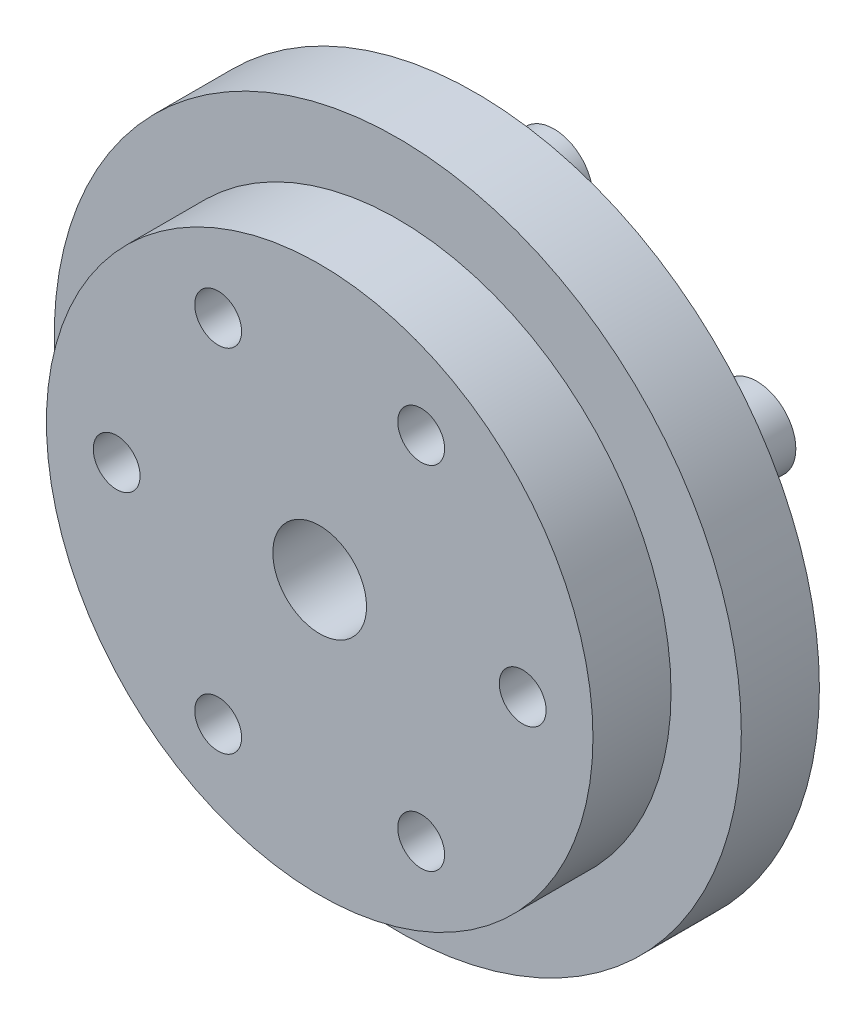
from build123d import *

# Parameters (mm, degrees)
SKETCH1_R           = 22
BOSS_EXTRUDE1_DEPTH = 5
SKETCH2_R           = 17.5
BOSS_EXTRUDE2_DEPTH = 5
SKETCH4_R           = 8
CUT_EXTRUDE2_DEPTH  = 10
SKETCH5_R           = 1.5
CUT_EXTRUDE3_DEPTH  = 3
SKETCH7_R           = 2.5
BOSS_EXTRUDE4_DEPTH = 5
SKETCH8_R           = 8
SKETCH8_R_2         = 3
BOSS_EXTRUDE5_DEPTH = 5


with BuildPart() as part:
    # Sketch1 → Boss-Extrude1 (new body)
    with BuildSketch(Plane.XY):
        Circle(SKETCH1_R)
    extrude(amount=BOSS_EXTRUDE1_DEPTH)

    # Sketch2 → Boss-Extrude2 (add)
    with BuildSketch(Plane.XY.offset(5)):
        Circle(SKETCH2_R)
    extrude(amount=BOSS_EXTRUDE2_DEPTH)

    # Sketch4 → Cut-Extrude2 (cut)
    with BuildSketch(Plane.XY.offset(10)):
        Circle(SKETCH4_R)
    extrude(amount=-CUT_EXTRUDE2_DEPTH, mode=Mode.SUBTRACT)

    # Sketch5 → Cut-Extrude3 (cut)
    with BuildSketch(Plane.XY.offset(10)):
        with Locations((13, 0)):
            Circle(SKETCH5_R)
        with Locations((6.5, -11.258330249)):
            Circle(SKETCH5_R)
        with Locations((-6.5, -11.258330249)):
            Circle(SKETCH5_R)
        with Locations((-13, 0)):
            Circle(SKETCH5_R)
        with Locations((-6.5, 11.258330249)):
            Circle(SKETCH5_R)
        with Locations((6.5, 11.258330249)):
            Circle(SKETCH5_R)
    extrude(amount=-CUT_EXTRUDE3_DEPTH, mode=Mode.SUBTRACT)

    # Sketch7 → Boss-Extrude4 (add)
    with BuildSketch(Plane(origin=(0, 0, 0), x_dir=(-1, 0, 0), z_dir=(0, 0, -1))):
        with Locations(Location((0, 15, 0), (0, 0, 180))):
            Circle(SKETCH7_R)
        with Locations(Location((12.990381057, 7.5, 0), (0, 0, 180))):
            Circle(SKETCH7_R)
        with Locations(Location((12.990381057, -7.5, 0), (0, 0, 180))):
            Circle(SKETCH7_R)
        with Locations(Location((0, -15, 0), (0, 0, 180))):
            Circle(SKETCH7_R)
        with Locations(Location((-12.990381057, -7.5, 0), (0, 0, 180))):
            Circle(SKETCH7_R)
        with Locations(Location((-12.990381057, 7.5, 0), (0, 0, 180))):
            Circle(SKETCH7_R)
    extrude(amount=BOSS_EXTRUDE4_DEPTH)

    # Sketch8 → Boss-Extrude5 (add)
    with BuildSketch(Plane.XY.offset(10)):
        Circle(SKETCH8_R)
        Circle(SKETCH8_R_2, mode=Mode.SUBTRACT)
    extrude(amount=-BOSS_EXTRUDE5_DEPTH)


solid = part.part
